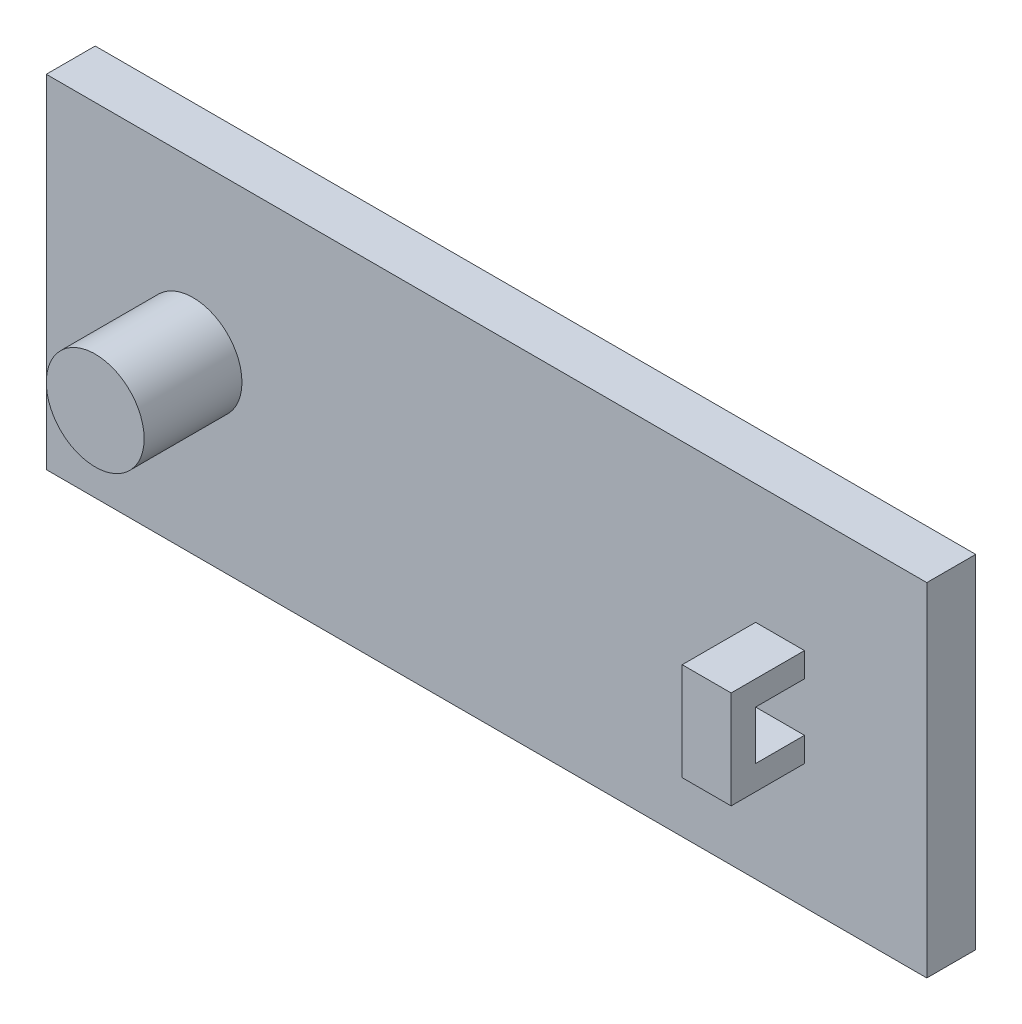
from build123d import *

# Parameters (mm, degrees)
SKETCH_1_W      = 18
SKETCH_1_H      = 7
EXTRUDE_1_DEPTH = 1
SKETCH_3_R      = 1
EXTRUDE_2_DEPTH = 2
EXTRUDE_4_DEPTH = 0.5


with BuildPart() as part:
    # 草图1 → 凸台-拉伸1 (new body)
    with BuildSketch(Plane.XY):
        with Locations((-5.532426778, 1.915271967)):
            Rectangle(SKETCH_1_W, SKETCH_1_H)
    extrude(amount=EXTRUDE_1_DEPTH)

    # 草图3 → 凸台-拉伸2 (add)
    with BuildSketch(Plane.XY.offset(1)):
        with Locations((-11.532426778, 1.961868549)):
            Circle(SKETCH_3_R)
    extrude(amount=EXTRUDE_2_DEPTH)

    # 草图7 → 凸台-拉伸4 (add, symmetric)
    with BuildSketch(Plane(origin=(0.467573222, 0, 0), x_dir=(0, 0, -1), z_dir=(1, 0, 0))):
        Polygon((-2.5, 0.961868549), (-1, 0.961868549), (-1, 1.461868549), (-2, 1.461868549), (-2, 2.461868549), (-1, 2.461868549), (-1, 2.961868549), (-2.5, 2.961868549), align=None)
    extrude(amount=EXTRUDE_4_DEPTH, both=True)


solid = part.part
